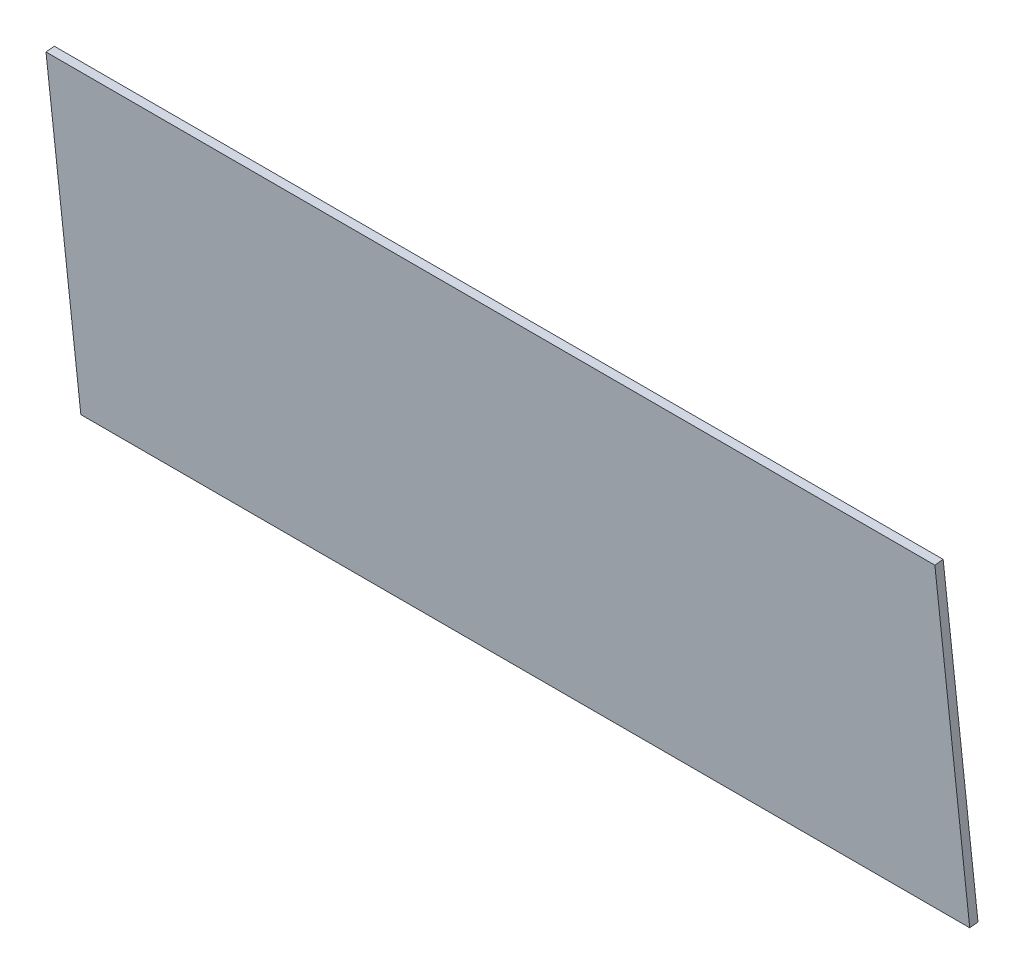
from build123d import *

# Parameters (mm, degrees)
BOSS_EXTRUDE1_DEPTH = 3


with BuildPart() as part:
    # Sketch1 → Boss-Extrude1 (new body)
    with BuildSketch(Plane(origin=(0, 21.836208733, -207.75764818), x_dir=(0.9643573888802595, -0.26315362536035997, -0.027658560550890932), z_dir=(0, -0.10452846326765347, 0.9945218953682734))):
        Polygon((206.194284224, -1065.303662697), (514.788648666, -980.630654986), (546.541026558, -1096.353541651), (237.946662116, -1181.026549362), align=None)
    extrude(amount=BOSS_EXTRUDE1_DEPTH)


solid = part.part
